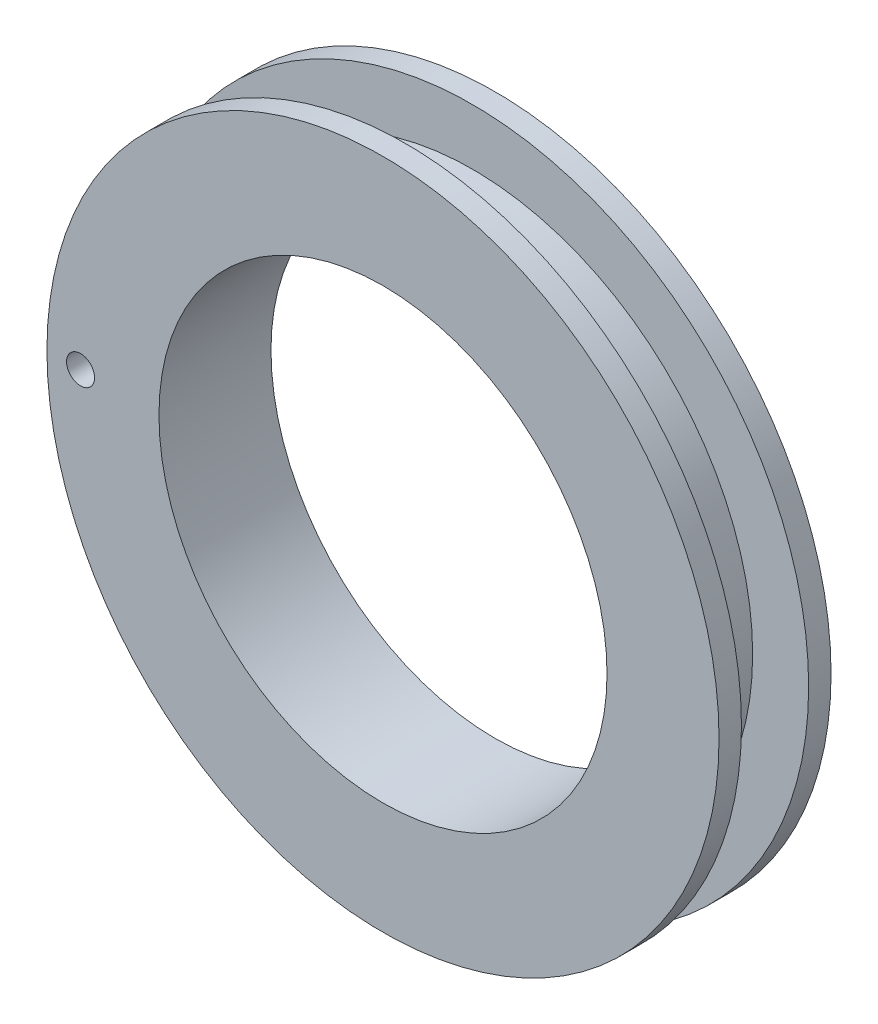
from build123d import *

# Parameters (mm, degrees)
SKETCH_2_R               = 25
EXTRUDE_1_DEPTH          = 6
SKETCH_3_R               = 30
EXTRUDE_2_DEPTH          = 2
EXTRUDE_START            = 2
SKETCH_4_R               = 30
EXTRUDE_4_DEPTH          = 2
CUT_EXTRUDE_1_DEPTH      = 44.588989435
CUT_EXTRUDE_1_DEPTH_BACK = 44.588989435
SKETCH_5_R               = 20
CUT_EXTRUDE_3_DEPTH      = 44.588989435
CUT_EXTRUDE_3_DEPTH_BACK = 44.588989435
SKETCH_7_R               = 1.25


with BuildPart() as part:
    # 스케치2 → 보스-돌출1 (new body)
    with BuildSketch(Plane.XY):
        Circle(SKETCH_2_R)
    extrude(amount=EXTRUDE_1_DEPTH)

    # 스케치3 → 보스-돌출2 (add)
    with BuildSketch(Plane.XY.offset(6)):
        Circle(SKETCH_3_R)
    extrude(amount=EXTRUDE_2_DEPTH)

    # 스케치4 → 보스-돌출4 (add)
    with BuildSketch(Plane(origin=(0, 0, 0), x_dir=(-1, 0, 0), z_dir=(0, 0, -1)).offset(EXTRUDE_START)):
        with Locations(Location((0, 0, 0), (0, 0, 180))):
            Circle(SKETCH_4_R)
    extrude(amount=-EXTRUDE_4_DEPTH)

    # 스케치5 → 컷-돌출1 (cut, two sides: drawn at the far end of the back side and taken through both)
    with BuildSketch(Plane(origin=(0, 0, -2), x_dir=(-1, 0, 0), z_dir=(0, 0, -1)).offset(-CUT_EXTRUDE_1_DEPTH_BACK)):
        Circle(SKETCH_5_R)
    extrude(amount=CUT_EXTRUDE_1_DEPTH + CUT_EXTRUDE_1_DEPTH_BACK, mode=Mode.SUBTRACT)

    # 스케치7 → 컷-돌출3 (cut, two sides: drawn at the far end of the back side and taken through both)
    with BuildSketch(Plane.XY.offset(8).offset(-CUT_EXTRUDE_3_DEPTH_BACK)):
        with Locations((-27, 0)):
            Circle(SKETCH_7_R)
    extrude(amount=CUT_EXTRUDE_3_DEPTH + CUT_EXTRUDE_3_DEPTH_BACK, mode=Mode.SUBTRACT)


solid = part.part
